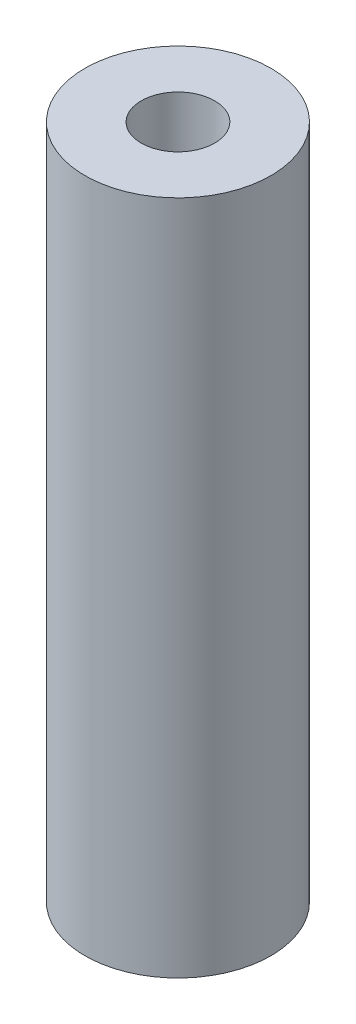
from build123d import *

# Parameters (mm, degrees)
SKETCH2_R           = 5.2451
SKETCH2_R_2         = 2.0701
BOSS_EXTRUDE1_DEPTH = 19.05


with BuildPart() as part:
    # Sketch2 → Boss-Extrude1 (new, symmetric)
    with BuildSketch(Plane(origin=(0, 0, 0), x_dir=(1, 0, 0), z_dir=(0, 1, 0))):
        with Locations(Location((0, 0, 0), (0, 0, 90))):
            Circle(SKETCH2_R)
        with Locations(Location((0, 0, 0), (0, 0, 90))):
            Circle(SKETCH2_R_2, mode=Mode.SUBTRACT)
    extrude(amount=BOSS_EXTRUDE1_DEPTH, both=True)


solid = part.part
